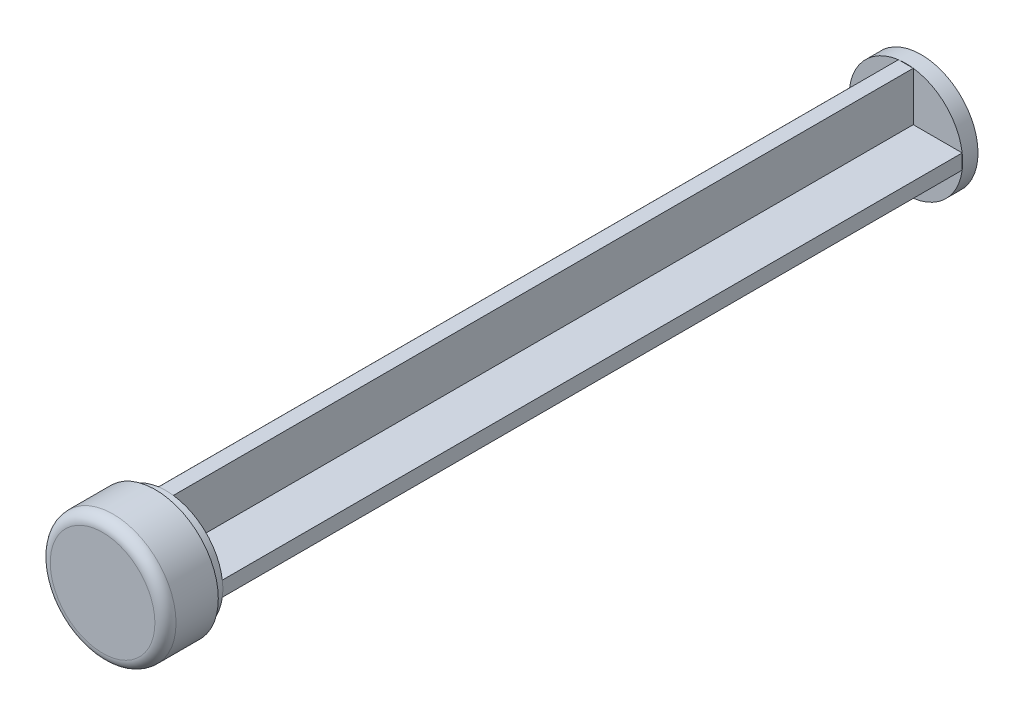
from build123d import *

# Parameters (mm, degrees)
CROQUIS1_R              = 5.95
SALIENTE_EXTRUIR1_DEPTH = 5
CROQUIS2_R              = 5.375
SALIENTE_EXTRUIR2_DEPTH = 1
CROQUIS4_W              = 1.4
CROQUIS4_H              = 4.624223677
CROQUIS4_H_2            = 1.41
CROQUIS4_W_2            = 4.628564535
SALIENTE_EXTRUIR3_DEPTH = 70
REDONDEO1_R             = 1
CROQUIS5_R              = 5.375
SALIENTE_EXTRUIR4_DEPTH = 1.45


with BuildPart() as part:
    # Croquis1 → Saliente-Extruir1 (new body)
    with BuildSketch(Plane.XY):
        Circle(CROQUIS1_R)
    extrude(amount=SALIENTE_EXTRUIR1_DEPTH)

    # Croquis2 → Saliente-Extruir2 (add)
    with BuildSketch(Plane(origin=(0, 0, 0), x_dir=(-1, 0, 0), z_dir=(0, 0, -1))):
        Circle(CROQUIS2_R)
    extrude(amount=SALIENTE_EXTRUIR2_DEPTH)

    # Croquis4 → Saliente-Extruir3 (add)
    with BuildSketch(Plane(origin=(0, 0, -1), x_dir=(-1, 0, 0), z_dir=(0, 0, -1))):
        with Locations((0, 3.017111839)):
            Rectangle(CROQUIS4_W, CROQUIS4_H)
        Rectangle(CROQUIS4_W, CROQUIS4_H_2)
        with Locations((0, -3.017111839)):
            Rectangle(CROQUIS4_W, CROQUIS4_H)
        with Locations((-3.014282268, 0)):
            Rectangle(CROQUIS4_W_2, CROQUIS4_H_2)
        with Locations((3.014282268, 0)):
            Rectangle(CROQUIS4_W_2, CROQUIS4_H_2)
    extrude(amount=SALIENTE_EXTRUIR3_DEPTH)

    # Redondeo1
    redondeo1_edges = [part.edges().sort_by_distance(p)[0] for p in [
        (-5.95, 0, 5),
    ]]
    fillet(redondeo1_edges, radius=REDONDEO1_R)

    # Croquis5 → Saliente-Extruir4 (add)
    with BuildSketch(Plane(origin=(0, 0, -71), x_dir=(-1, 0, 0), z_dir=(0, 0, -1))):
        with Locations(Location((0, 0, 0), (0, 0, 172.4632093))):
            Circle(CROQUIS5_R)
    extrude(amount=SALIENTE_EXTRUIR4_DEPTH)


solid = part.part
